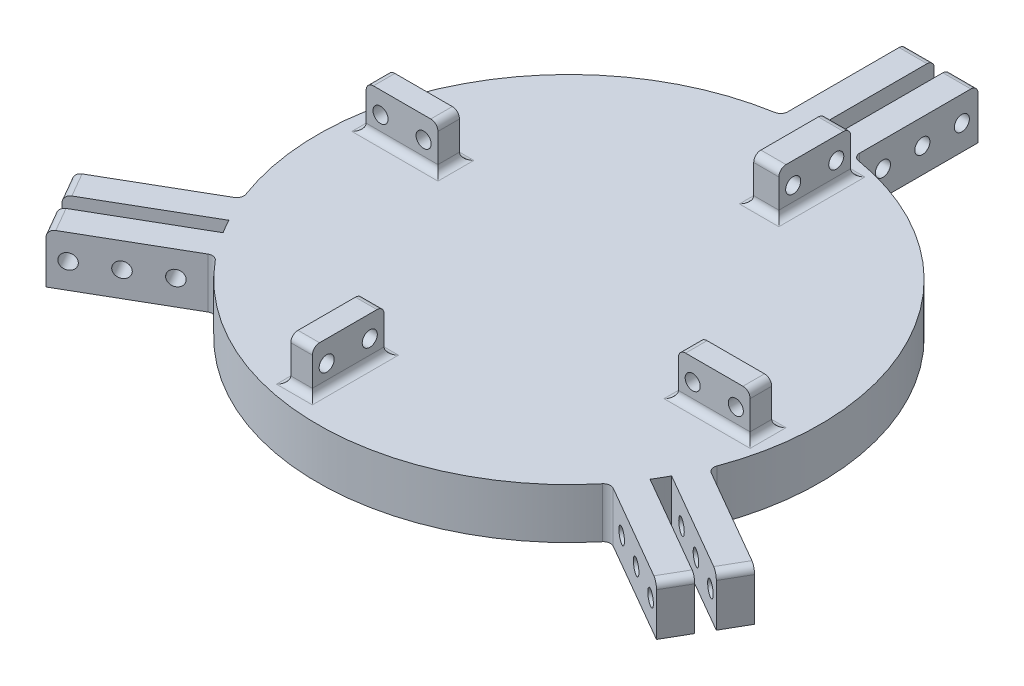
from build123d import *

# Parameters (mm, degrees)
SKETCH1_R           = 35
BOSS_EXTRUDE1_DEPTH = 7
SKETCH2_W           = 3.5
SKETCH2_H           = 10
SKETCH2_W_2         = 10
SKETCH2_H_2         = 3
SKETCH2_W_3         = 3
BOSS_EXTRUDE2_DEPTH = 6
SKETCH3_W           = 3.9
SKETCH3_H           = 22
BOSS_EXTRUDE3_DEPTH = 7
SKETCH4_R           = 1.05
CUT_EXTRUDE1_DEPTH  = 10
CIRPATTERN1_COUNT   = 3
SKETCH5_R           = 1.05
CUT_EXTRUDE2_DEPTH  = 75.18206665
CIRPATTERN2_COUNT   = 4
FILLET1_R           = 1


with BuildPart() as part:
    # Sketch1 → Boss-Extrude1 (new body)
    with BuildSketch(Plane(origin=(0, 0, 0), x_dir=(1, 0, 0), z_dir=(0, 1, 0))):
        with Locations(Location((0, 0, 0), (0, 0, 270))):
            Circle(SKETCH1_R)
    extrude(amount=BOSS_EXTRUDE1_DEPTH)

    # Sketch2 → Boss-Extrude2 (add)
    with BuildSketch(Plane(origin=(0, 7, 0), x_dir=(1, 0, 0), z_dir=(0, 1, 0))):
        with Locations((5.5, 27)):
            Rectangle(SKETCH2_W, SKETCH2_H)
        with Locations((-27, 5.25)):
            Rectangle(SKETCH2_W_2, SKETCH2_H_2)
        with Locations((-5.25, -27)):
            Rectangle(SKETCH2_W_3, SKETCH2_H)
        with Locations((27, -5.25)):
            Rectangle(SKETCH2_W_2, SKETCH2_H_2)
    extrude(amount=BOSS_EXTRUDE2_DEPTH)

    # Sketch3 → Boss-Extrude3 (add)
    with BuildSketch(Plane(origin=(0, 0, 0), x_dir=(1, 0, 0), z_dir=(0, 1, 0))):
        with Locations((3.05, 41)):
            Rectangle(SKETCH3_W, SKETCH3_H)
        with Locations((-3.05, 41)):
            Rectangle(SKETCH3_W, SKETCH3_H)
        Polygon((23.480762114, -19.330127019), (25.430762114, -15.952627944), (44.483320997, -26.952627944), (42.533320997, -30.330127019), align=None)
        Polygon((28.480762114, -10.669872981), (26.530762114, -14.047372056), (45.583320997, -25.047372056), (47.533320997, -21.669872981), align=None)
        Polygon((-28.480762114, -10.669872981), (-26.530762114, -14.047372056), (-45.583320997, -25.047372056), (-47.533320997, -21.669872981), align=None)
        Polygon((-23.480762114, -19.330127019), (-25.430762114, -15.952627944), (-44.483320997, -26.952627944), (-42.533320997, -30.330127019), align=None)
    extrude(amount=BOSS_EXTRUDE3_DEPTH)

    # Sketch4 → Cut-Extrude1 (cut)
    with BuildSketch(Plane(origin=(5, 0, 0), x_dir=(0, 0, -1), z_dir=(1, 0, 0))):
        with Locations((49.75, 3.5)):
            Circle(SKETCH4_R)
        with Locations((44.25, 3.5)):
            Circle(SKETCH4_R)
        with Locations((38.75, 3.5)):
            Circle(SKETCH4_R)
    cut_extrude1 = extrude(amount=-CUT_EXTRUDE1_DEPTH, mode=Mode.SUBTRACT)

    # CirPattern1: Cut-Extrude1 ×3 about axis
    cirpattern1_axis = Axis((0, 13.65, 0), (0, -1, 0))
    for i in range(1, CIRPATTERN1_COUNT):
        add(cut_extrude1.rotate(cirpattern1_axis, i * 360 / CIRPATTERN1_COUNT), mode=Mode.SUBTRACT)

    # Sketch5 → Cut-Extrude2 (cut, through all)
    with BuildSketch(Plane.ZY.offset(-3.75)):
        with Locations((-30, 10)):
            Circle(SKETCH5_R)
        with Locations((-24, 10)):
            Circle(SKETCH5_R)
    cut_extrude2 = extrude(amount=-CUT_EXTRUDE2_DEPTH, mode=Mode.SUBTRACT)

    # CirPattern2: Cut-Extrude2 ×4 about axis
    cirpattern2_axis = Axis((0, 13.65, 0), (0, -1, 0))
    for i in range(1, CIRPATTERN2_COUNT):
        add(cut_extrude2.rotate(cirpattern2_axis, i * 360 / CIRPATTERN2_COUNT), mode=Mode.SUBTRACT)

    # Fillet1
    fillet1_edges = [part.edges().sort_by_distance(p)[0] for p in [
        (5.5, 13, -22),
        (27.5, 3.5, 21.650635095),
        (43.508320997, 7, 28.641377482),
        (32.5, 3.5, 12.990381057),
        (46.558320997, 7, 23.358622518),
        (-32.5, 3.5, 12.990381057),
        (-46.558320997, 7, 23.358622518),
        (-27.5, 3.5, 21.650635095),
        (-43.508320997, 7, 28.641377482),
        (-3.75, 7, 27),
        (-5.25, 7, 22),
        (-6.75, 7, 27),
        (-5.25, 7, 32),
        (-5.25, 13, 22),
        (-5.25, 13, 32),
        (-22, 7, -5.25),
        (-27, 7, -6.75),
        (-32, 7, -5.25),
        (-27, 7, -3.75),
        (-22, 13, -5.25),
        (-32, 13, -5.25),
        (22, 7, 5.25),
        (27, 7, 6.75),
        (32, 7, 5.25),
        (27, 7, 3.75),
        (22, 13, 5.25),
        (32, 13, 5.25),
        (5, 3.5, -34.641016151),
        (3.05, 7, -52),
        (7.25, 7, -27),
        (5.5, 7, -32),
        (-5, 3.5, -34.641016151),
        (-3.05, 7, -52),
        (3.75, 7, -27),
        (5.5, 7, -22),
        (5.5, 13, -32),
    ]]
    fillet(fillet1_edges, radius=FILLET1_R)


solid = part.part
